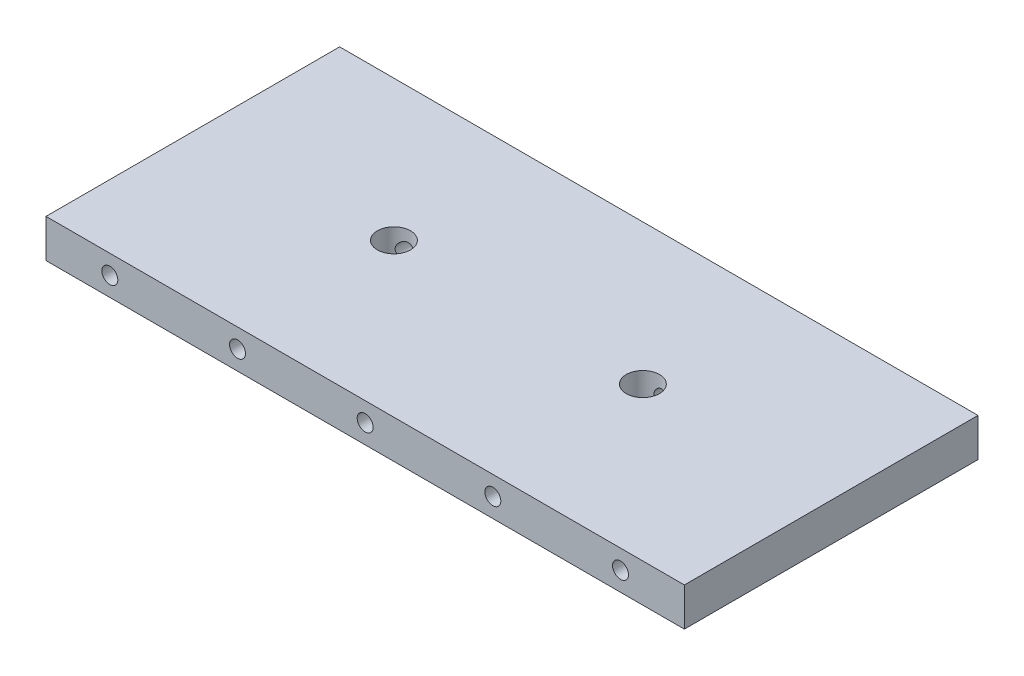
from build123d import *

# Parameters (mm, degrees)
SKETCH1_W                    = 100
SKETCH1_H                    = 46
BOSS_EXTRUDE1_DEPTH          = 6
TAP_DRILL_FOR_M3_TAP1_D      = 2.5
TAP_DRILL_FOR_M5_HELICOIL1_D = 5.2


with BuildPart() as part:
    # Sketch1 → Boss-Extrude1 (new body)
    with BuildSketch(Plane(origin=(0, 0, 0), x_dir=(1, 0, 0), z_dir=(0, 1, 0))):
        with Locations((50, 23)):
            Rectangle(SKETCH1_W, SKETCH1_H)
    extrude(amount=BOSS_EXTRUDE1_DEPTH)

    # Tap Drill for M3 Tap1 (through all)
    with Locations(Plane(origin=(0, 0, -46), x_dir=(-1, 0, 0), z_dir=(0, 0, -1))):
        with Locations((-90, 3), (-70, 3), (-50, 3), (-30, 3), (-10, 3)):
            Hole(TAP_DRILL_FOR_M3_TAP1_D / 2)

    # Tap Drill for M5 Helicoil1 (through all)
    with Locations(Plane(origin=(0, 6, 0), x_dir=(1, 0, 0), z_dir=(0, 1, 0))):
        with Locations((30.5, 24), (69.5, 24)):
            Hole(TAP_DRILL_FOR_M5_HELICOIL1_D / 2)


solid = part.part
